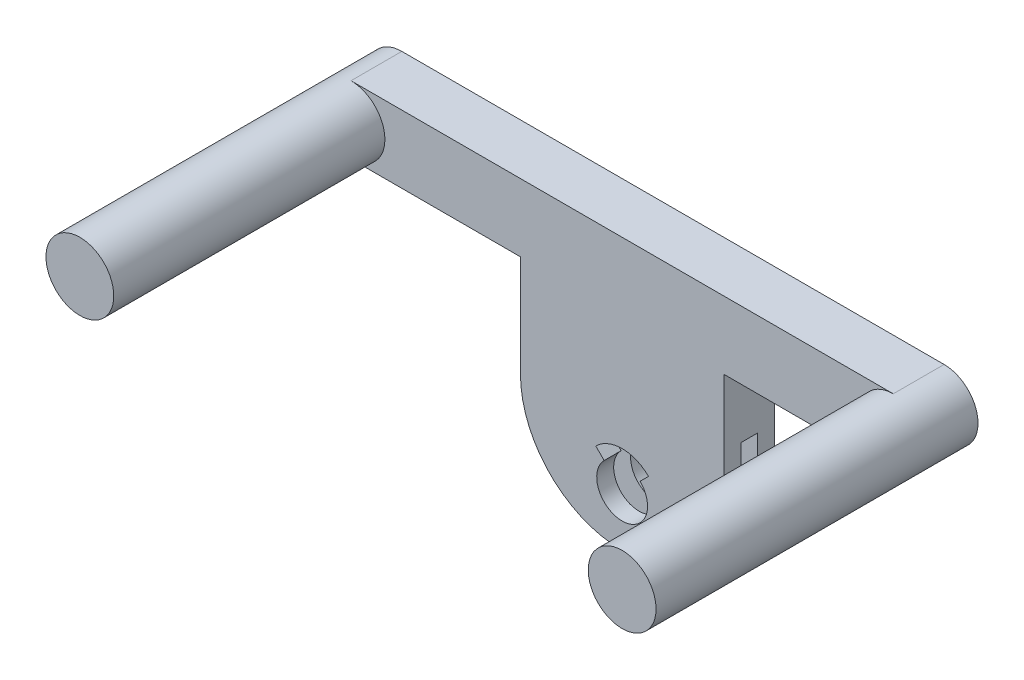
from build123d import *

# Parameters (mm, degrees)
SKETCH_1_R          = 20
EXTRUDE_1_DEPTH     = 30
EXTRUDE_2_DEPTH     = 10
EXTRUDE_START       = -10
EXTRUDE_3_DEPTH     = 10
CUT_EXTRUDE_1_DEPTH = 30
SKETCH_6_W          = 120
SKETCH_6_H          = 10
CUT_EXTRUDE_2_DEPTH = 20
SKETCH_7_R          = 20
EXTRUDE_4_DEPTH     = 160


with BuildPart() as part:
    # 草图1 → 凸台-拉伸1 (new body)
    with BuildSketch(Plane.XY):
        with Locations((-197.711448945, 94.32879439)):
            Circle(SKETCH_1_R)
        with Locations((122.288551055, 94.32879439)):
            Circle(SKETCH_1_R)
        Polygon((-197.711448945, 114.32879439), (122.288551055, 114.32879439), (122.288551055, 74.32879439), (22.288551055, 74.32879439), (22.288551055, 14.32879439), (-97.711448945, 14.32879439), (-97.711448945, 74.32879439), (-197.711448945, 74.32879439), align=None)
    extrude(amount=EXTRUDE_1_DEPTH)

    # 草图3 → 凸台-拉伸2 (add)
    with BuildSketch(Plane(origin=(0, 0, 0), x_dir=(-1, 0, 0), z_dir=(0, 0, -1))):
        with BuildLine():
            ThreePointArc((97.711448945, 14.32879439), (37.711448945, 74.32879439), (-22.288551055, 14.32879439))
            Line((-22.288551055, 14.32879439), (97.711448945, 14.32879439))
        make_face()
        with BuildLine():
            Line((97.711448945, 14.32879439), (-22.288551055, 14.32879439))
            ThreePointArc((-22.288551055, 14.32879439), (37.711448945, -45.67120561), (97.711448945, 14.32879439))
        make_face()
    extrude(amount=-EXTRUDE_2_DEPTH)

    # 草图4 → 凸台-拉伸3 (add)
    with BuildSketch(Plane.XY.offset(30).offset(EXTRUDE_START)):
        with BuildLine():
            ThreePointArc((22.288551055, 14.32879439), (-37.711448945, 74.32879439), (-97.711448945, 14.32879439))
            Line((-97.711448945, 14.32879439), (22.288551055, 14.32879439))
        make_face()
        with BuildLine():
            Line((22.288551055, 14.32879439), (-97.711448945, 14.32879439))
            ThreePointArc((-97.711448945, 14.32879439), (-37.711448945, -45.67120561), (22.288551055, 14.32879439))
        make_face()
    extrude(amount=EXTRUDE_3_DEPTH)

    # 草图5 → 切除-拉伸1 (cut)
    with BuildSketch(Plane.XY.offset(30)):
        with BuildLine():
            ThreePointArc((-37.711448945, 6.32879439), (-46.130484457, 4.654144105), (-53.267798131, -0.114856424))
            Line((-53.267798131, -0.114856424), (-48.318050663, -5.064603892))
            ThreePointArc((-48.318050663, -5.064603892), (-43.45170043, -1.813012622), (-37.711448945, -0.67120561))
            Line((-37.711448945, -0.67120561), (-37.711448945, 6.32879439))
        make_face()
        with BuildLine():
            ThreePointArc((-22.155099759, -0.114856424), (-29.292413433, 4.654144105), (-37.711448945, 6.32879439))
            Line((-37.711448945, 6.32879439), (-37.711448945, -0.67120561))
            ThreePointArc((-37.711448945, -0.67120561), (-31.971197459, -1.813012622), (-27.104847227, -5.064603892))
            Line((-27.104847227, -5.064603892), (-22.155099759, -0.114856424))
        make_face()
        with BuildLine():
            ThreePointArc((-27.104847227, -5.064603892), (-31.971197459, -1.813012622), (-37.711448945, -0.67120561))
            Line((-37.711448945, -0.67120561), (-37.711448945, -15.67120561))
            Line((-37.711448945, -15.67120561), (-27.104847227, -5.064603892))
        make_face()
        with BuildLine():
            ThreePointArc((-37.711448945, -0.67120561), (-43.45170043, -1.813012622), (-48.318050663, -5.064603892))
            Line((-48.318050663, -5.064603892), (-37.711448945, -15.67120561))
            Line((-37.711448945, -15.67120561), (-37.711448945, -0.67120561))
        make_face()
        with BuildLine():
            Line((-37.711448945, -15.67120561), (-48.318050663, -5.064603892))
            ThreePointArc((-48.318050663, -5.064603892), (-43.45170043, -29.529398598), (-22.711448945, -15.67120561))
            ThreePointArc((-22.711448945, -15.67120561), (-23.853255957, -9.930954125), (-27.104847227, -5.064603892))
            Line((-27.104847227, -5.064603892), (-37.711448945, -15.67120561))
        make_face()
    extrude(amount=-CUT_EXTRUDE_1_DEPTH, mode=Mode.SUBTRACT)

    # 草图6 → 切除-拉伸2 (cut)
    with BuildSketch(Plane.XZ.offset(-14.32879439)):
        with Locations((-37.711448945, 15)):
            Rectangle(SKETCH_6_W, SKETCH_6_H)
    extrude(amount=-CUT_EXTRUDE_2_DEPTH, mode=Mode.SUBTRACT)

    # 草图7 → 凸台-拉伸4 (add)
    with BuildSketch(Plane.XY.offset(30)):
        with Locations(Location((-197.711448945, 94.32879439, 0), (0, 0, 90))):
            Circle(SKETCH_7_R)
        with Locations(Location((122.288551055, 94.32879439, 0), (0, 0, 90))):
            Circle(SKETCH_7_R)
    extrude(amount=EXTRUDE_4_DEPTH)


solid = part.part
